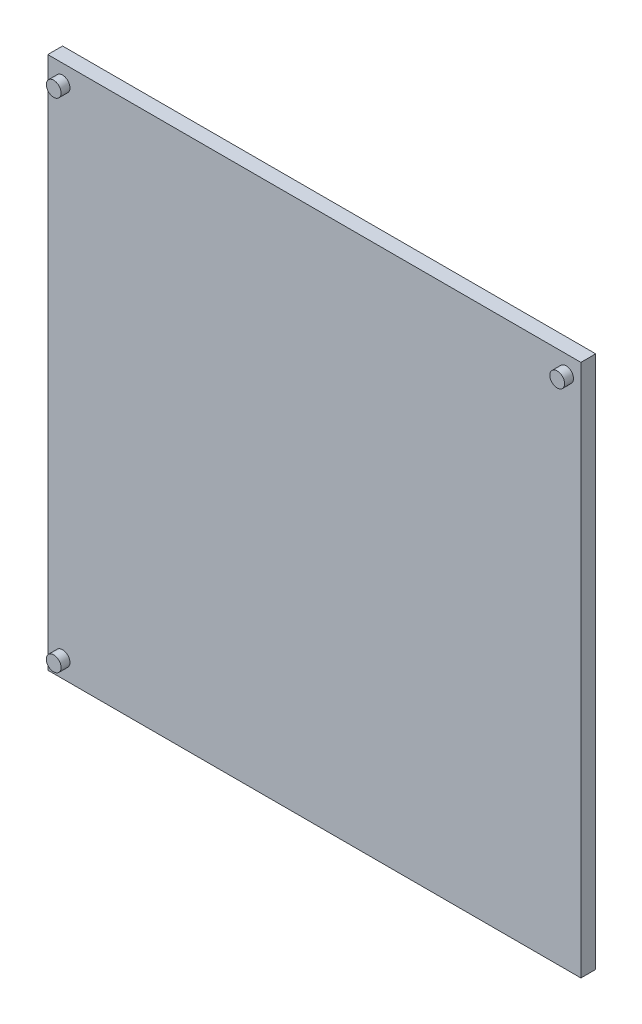
from build123d import *

# Parameters (mm, degrees)
SKETCH1_W           = 90
SKETCH1_H           = 90
BOSS_EXTRUDE1_DEPTH = 2.5
SKETCH2_R           = 1.25
BOSS_EXTRUDE2_DEPTH = 1.5


with BuildPart() as part:
    # Sketch1 → Boss-Extrude1 (new body)
    with BuildSketch(Plane.XY):
        Rectangle(SKETCH1_W, SKETCH1_H)
    extrude(amount=BOSS_EXTRUDE1_DEPTH)

    # Sketch2 → Boss-Extrude2 (add)
    with BuildSketch(Plane.XY.offset(2.5)):
        with Locations(Location((-42.5, 42, 0), (0, 0, 180))):
            Circle(SKETCH2_R)
        with Locations(Location((42.5, 42, 0), (0, 0, 180))):
            Circle(SKETCH2_R)
        with Locations(Location((-42.5, -42, 0), (0, 0, 180))):
            Circle(SKETCH2_R)
    extrude(amount=BOSS_EXTRUDE2_DEPTH)


solid = part.part
